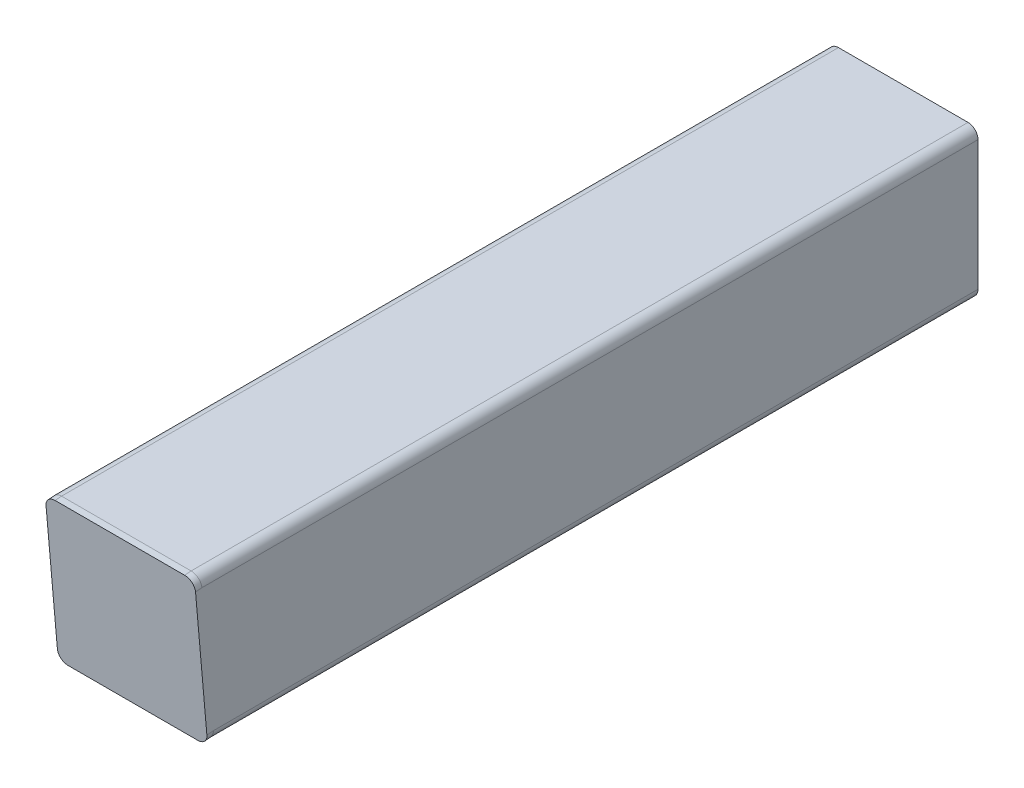
from build123d import *

# Parameters (mm, degrees)
BOSS_EXTRUDE1_DEPTH = 198
CUT_EXTRUDE3_DEPTH  = 206.200438596
BOSS_EXTRUDE2_DEPTH = 1.636319424


with BuildPart() as part:
    # Sketch1 → Boss-Extrude1 (new body)
    with BuildSketch(Plane.XY):
        with BuildLine():
            Line((2.54, 0), (35.56, 0))
            ThreePointArc((35.56, 0), (37.356051224, -0.743948776), (38.1, -2.54))
            Line((38.1, -2.54), (38.1, -35.56))
            ThreePointArc((38.1, -35.56), (37.356051224, -37.356051224), (35.56, -38.1))
            Line((35.56, -38.1), (2.54, -38.1))
            ThreePointArc((2.54, -38.1), (0.743948776, -37.356051224), (0, -35.56))
            Line((0, -35.56), (0, -2.54))
            ThreePointArc((0, -2.54), (0.743948776, -0.743948776), (2.54, 0))
        make_face()
        with BuildLine():
            Line((5.3086, -2.7686), (32.7914, -2.7686))
            ThreePointArc((32.7914, -2.7686), (34.587451224, -3.512548776), (35.3314, -5.3086))
            Line((35.3314, -5.3086), (35.3314, -32.7914))
            ThreePointArc((35.3314, -32.7914), (34.587451224, -34.587451224), (32.7914, -35.3314))
            Line((32.7914, -35.3314), (5.3086, -35.3314))
            ThreePointArc((5.3086, -35.3314), (3.512548776, -34.587451224), (2.7686, -32.7914))
            Line((2.7686, -32.7914), (2.7686, -5.3086))
            ThreePointArc((2.7686, -5.3086), (3.512548776, -3.512548776), (5.3086, -2.7686))
        make_face(mode=Mode.SUBTRACT)
    extrude(amount=BOSS_EXTRUDE1_DEPTH)

    # Sketch3 → Cut-Extrude3 (cut, through all)
    with BuildSketch(Plane(origin=(38.1, 0, 0), x_dir=(0, 0, -1), z_dir=(1, 0, 0))):
        Polygon((-198, 0), (-194.66668192, -38.1), (-198, -38.1), align=None)
    extrude(amount=-CUT_EXTRUDE3_DEPTH, mode=Mode.SUBTRACT)

    # Sketch4 → Boss-Extrude2 (add)
    with BuildSketch(Plane(origin=(0, -17.191169589, 196.495967548), x_dir=(1, 0, 0), z_dir=(0, -0.08715574274765185, 0.9961946980917462))):
        with BuildLine():
            Line((2.54, -20.988698746), (35.56, -20.988698746))
            add(Edge.make_bspline(
                [(35.56, -20.988698746), (38.1, -20.988698746), (38.1, -18.438996359)],
                knots=[0, 0, 0, 1.570796327, 1.570796327, 1.570796327], degree=2, weights=[1, 0.707106781, 1]))
            Line((38.1, -18.438996359), (38.1, 14.707134677))
            add(Edge.make_bspline(
                [(38.1, 14.707134677), (38.1, 17.256837064), (35.56, 17.256837064)],
                knots=[4.71238898, 4.71238898, 4.71238898, 6.283185307, 6.283185307, 6.283185307], degree=2, weights=[1, 0.707106781, 1]))
            Line((35.56, 17.256837064), (2.54, 17.256837064))
            add(Edge.make_bspline(
                [(2.54, 17.256837064), (0, 17.256837064), (0, 14.707134677)],
                knots=[3.141592654, 3.141592654, 3.141592654, 4.71238898, 4.71238898, 4.71238898], degree=2, weights=[1, 0.707106781, 1]))
            Line((0, 14.707134677), (0, -18.438996359))
            add(Edge.make_bspline(
                [(0, -18.438996359), (0, -20.988698746), (2.54, -20.988698746)],
                knots=[4.71238898, 4.71238898, 4.71238898, 6.283185307, 6.283185307, 6.283185307], degree=2, weights=[1, 0.707106781, 1]))
        make_face()
    extrude(amount=BOSS_EXTRUDE2_DEPTH)


solid = part.part
